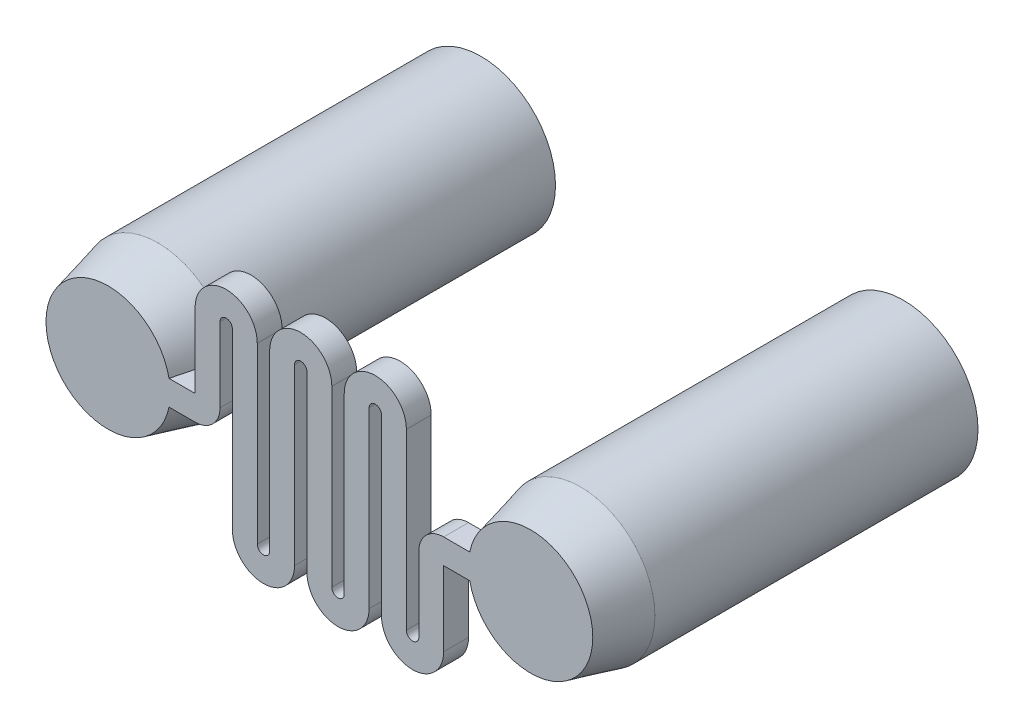
from build123d import *

# Parameters (mm, degrees)
BOSS_EXTRUDE1_DEPTH = 2
SKETCH5_R           = 5
CUT_EXTRUDE1_DEPTH  = 28


with BuildPart() as part:
    # Sketch2 → Boss-Extrude1 (new body)
    with BuildSketch(Plane.XY):
        with BuildLine():
            Line((-20.5, -1), (-13.5, -1))
            ThreePointArc((-13.5, -1), (-12.085786438, -0.414213562), (-11.5, 1))
            Line((-11.5, 1), (-11.5, 7))
            ThreePointArc((-11.5, 7), (-11, 7.5), (-10.5, 7))
            Line((-10.5, 7), (-10.5, 0))
            Line((-10.5, 0), (-10.5, -7))
            ThreePointArc((-10.5, -7), (-8, -9.5), (-5.5, -7))
            Line((-5.5, -7), (-5.5, 0))
            Line((-5.5, 0), (-5.5, 7))
            ThreePointArc((-5.5, 7), (-5, 7.5), (-4.5, 7))
            Line((-4.5, 7), (-4.5, 0))
            Line((-4.5, 0), (-4.5, -7))
            ThreePointArc((-4.5, -7), (-2, -9.5), (0.5, -7))
            Line((0.5, -7), (0.5, 0))
            Line((0.5, 0), (0.5, 7))
            ThreePointArc((0.5, 7), (1, 7.5), (1.5, 7))
            Line((1.5, 7), (1.5, 0))
            Line((1.5, 0), (1.5, -7))
            ThreePointArc((1.5, -7), (4, -9.5), (6.5, -7))
            Line((6.5, -7), (6.5, -1))
            Line((6.5, -1), (13.5, -1))
            ThreePointArc((13.5, -1), (14.5, 0), (13.5, 1))
            Line((13.5, 1), (6.5, 1))
            ThreePointArc((6.5, 1), (5.085786438, 0.414213562), (4.5, -1))
            Line((4.5, -1), (4.5, -7))
            ThreePointArc((4.5, -7), (4, -7.5), (3.5, -7))
            Line((3.5, -7), (3.5, 0))
            Line((3.5, 0), (3.5, 7))
            ThreePointArc((3.5, 7), (1, 9.5), (-1.5, 7))
            Line((-1.5, 7), (-1.5, 0))
            Line((-1.5, 0), (-1.5, -7))
            ThreePointArc((-1.5, -7), (-2, -7.5), (-2.5, -7))
            Line((-2.5, -7), (-2.5, 0))
            Line((-2.5, 0), (-2.5, 7))
            ThreePointArc((-2.5, 7), (-5, 9.5), (-7.5, 7))
            Line((-7.5, 7), (-7.5, 0))
            Line((-7.5, 0), (-7.5, -7))
            ThreePointArc((-7.5, -7), (-8, -7.5), (-8.5, -7))
            Line((-8.5, -7), (-8.5, 0))
            Line((-8.5, 0), (-8.5, 7))
            ThreePointArc((-8.5, 7), (-11, 9.5), (-13.5, 7))
            Line((-13.5, 7), (-13.5, 1))
            Line((-13.5, 1), (-20.5, 1))
            ThreePointArc((-20.5, 1), (-21.5, 0), (-20.5, -1))
        make_face()
    extrude(amount=BOSS_EXTRUDE1_DEPTH)

    # Sketch3 → Revolve1 (revolve)
    with BuildSketch(Plane(origin=(0, 0, 0), x_dir=(1, 0, 0), z_dir=(0, 1, 0)), mode=Mode.PRIVATE) as revolve1_sk:
        Polygon((-20.5, -2), (-25.5, -2), (-26.5, 2), (-26.5, 28), (-20.5, 28), align=None)
    revolve(revolve1_sk.sketch.rotate(Axis((-20.5, 0, 2), (0, 0, -1)), 168.463040967), axis=Axis((-20.5, 0, 2), (0, 0, -1)))

    # Sketch4 → Revolve2 (revolve)
    with BuildSketch(Plane(origin=(0, 0, 0), x_dir=(1, 0, 0), z_dir=(0, 1, 0)), mode=Mode.PRIVATE) as revolve2_sk:
        Polygon((13.5, -2), (18.5, -2), (19.5, 2), (19.5, 28), (13.5, 28), align=None)
    revolve(revolve2_sk.sketch.rotate(Axis((13.5, 0, 2), (0, 0, -1)), 169.524319524), axis=Axis((13.5, 0, 2), (0, 0, -1)))

    # Sketch5 → Cut-Extrude1 (cut)
    with BuildSketch(Plane(origin=(0, 0, -28), x_dir=(-1, 0, 0), z_dir=(0, 0, -1))):
        with Locations((-13.5, 0)):
            Circle(SKETCH5_R)
        with Locations((20.5, 0)):
            Circle(SKETCH5_R)
    extrude(amount=-CUT_EXTRUDE1_DEPTH, mode=Mode.SUBTRACT)


solid = part.part
